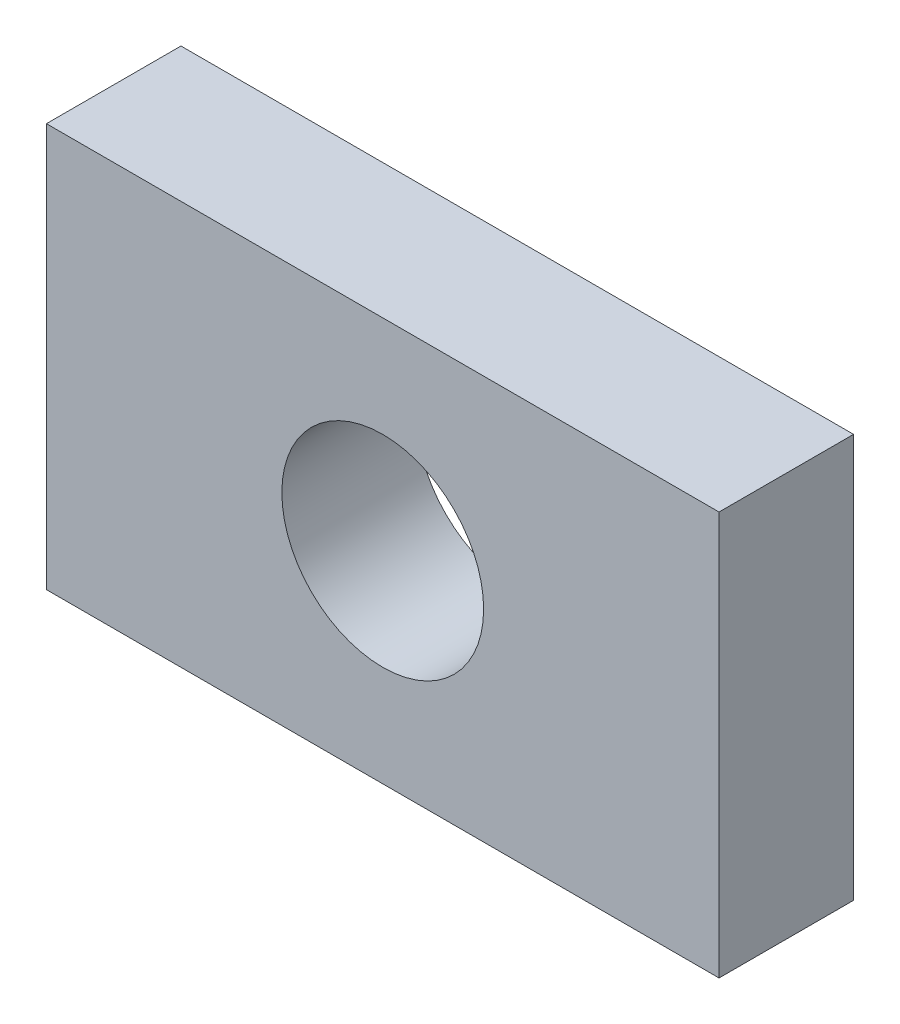
from build123d import *

# Parameters (mm, degrees)
MODEL_W             = 10
MODEL_H             = 6
MODEL_R             = 1.5
BOSS_EXTRUDE1_DEPTH = 2


with BuildPart() as part:
    # Model → Boss-Extrude1 (new body)
    with BuildSketch(Plane.XY):
        with Locations((2083.675952636, 1306.138337729)):
            Rectangle(MODEL_W, MODEL_H)
        with Locations((2083.675952636, 1306.138337729)):
            Circle(MODEL_R, mode=Mode.SUBTRACT)
    extrude(amount=BOSS_EXTRUDE1_DEPTH)


solid = part.part
